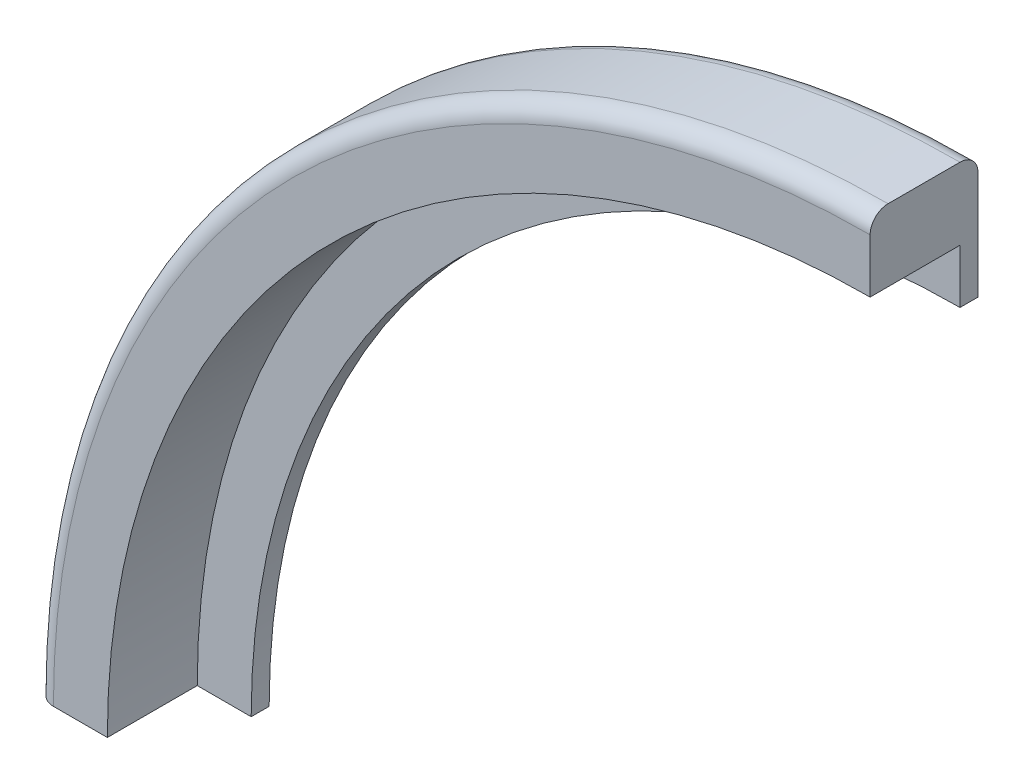
from build123d import *

# Parameters (mm, degrees)
SURFACE_EXTRUDE1_1_DEPTH = 5
THICKEN1_T2              = 4
BOSS_EXTRUDE1_DEPTH      = 1
FILLET1_R                = 1


with BuildPart() as body_1:
    # Surface-Extrude1: a surface, the sketch's curves swept straight by 5 mm
    with BuildLine(Plane.XY, mode=Mode.PRIVATE) as surface_extrude1_1_path:
        ThreePointArc((17.426406871192846, 25.000000000000007), (-12.573593128807143, 12.573593128807161), (-24.999999999999993, -17.42640687119283))
    surface_extrude1_1 = Shell.extrude(surface_extrude1_1_path.wire(), (0 * SURFACE_EXTRUDE1_1_DEPTH, 0 * SURFACE_EXTRUDE1_1_DEPTH, 1 * SURFACE_EXTRUDE1_1_DEPTH))
    add(Solid.thicken(surface_extrude1_1, -THICKEN1_T2))

    # Sketch2 → Boss-Extrude1 (add)
    with BuildSketch(Plane(origin=(0, 0, 0), x_dir=(-1, 0, 0), z_dir=(0, 0, -1))):
        with BuildLine():
            Line((-17.42640687119285, 29.00000000000001), (-17.426406871192853, 22.000000000000007))
            ThreePointArc((-17.426406871192853, 22.000000000000007), (10.452272785247494, 10.452272785247523), (21.999999999999993, -17.426406871192828))
            Line((21.999999999999993, -17.426406871192828), (24.999999999999993, -17.42640687119283))
            Line((24.999999999999993, -17.42640687119283), (28.999999999999996, -17.426406871192825))
            ThreePointArc((28.999999999999996, -17.426406871192825), (15.402020253553331, 15.402020253553353), (-17.42640687119285, 29.00000000000001))
        make_face()
    extrude(amount=BOSS_EXTRUDE1_DEPTH)

    # Fillet1
    fillet1_edges = [body_1.edges().sort_by_distance(p)[0] for p in [
        (-15.402020253553328, 15.40202025355335, 5),
        (-15.402020253553342, 15.40202025355336, -1),
    ]]
    fillet(fillet1_edges, radius=FILLET1_R)


solid = body_1.part
